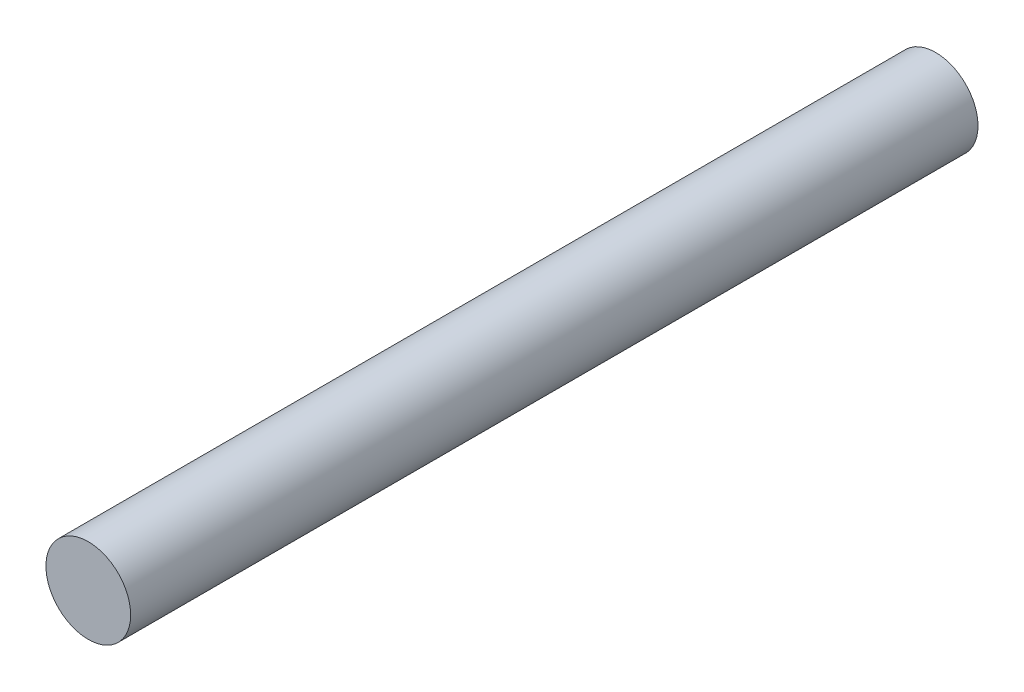
from build123d import *

# Parameters (mm, degrees)
ESBO_O1_R                       = 3
RESSALTO_EXTRUS_O1_DEPTH        = 60
FURO_ROSCADO_DE_M41_D           = 3.3
FURO_ROSCADO_DE_M41_DEPTH       = 20
FURO_ROSCADO_DE_M41_CSINK_D     = 4.05
FURO_ROSCADO_DE_M41_CSINK_ANGLE = 90
FURO_ROSCADO_DE_M41_TIP         = 0.991420021


with BuildPart() as part:
    # Esboço1 → Ressalto-extrusão1 (new body)
    with BuildSketch(Plane.XY):
        Circle(ESBO_O1_R)
    extrude(amount=RESSALTO_EXTRUS_O1_DEPTH)

    # Furo roscado de M41
    with Locations(Plane(origin=(0, 0, 0), x_dir=(-1, 0, 0), z_dir=(0, 0, -1))):
        with Locations((0, 0)):
            CounterSinkHole(FURO_ROSCADO_DE_M41_D / 2, FURO_ROSCADO_DE_M41_CSINK_D / 2, depth=FURO_ROSCADO_DE_M41_DEPTH, counter_sink_angle=FURO_ROSCADO_DE_M41_CSINK_ANGLE)
            with Locations((0, 0, -(FURO_ROSCADO_DE_M41_DEPTH + FURO_ROSCADO_DE_M41_TIP / 2))):  # 118° drill point
                Cone(0, FURO_ROSCADO_DE_M41_D / 2, FURO_ROSCADO_DE_M41_TIP, mode=Mode.SUBTRACT)


solid = part.part
